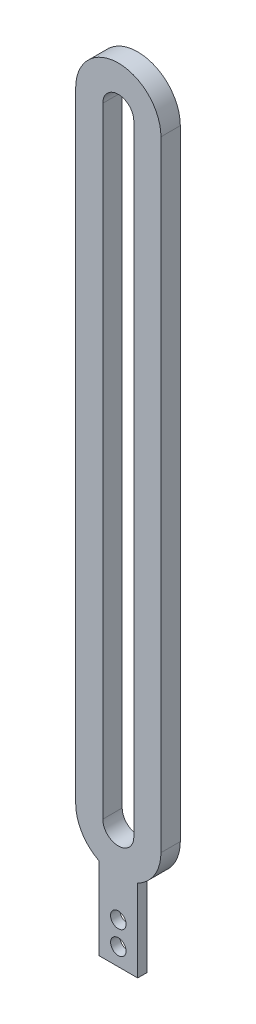
from build123d import *

# Parameters (mm, degrees)
BOSS_EXTRUDE1_DEPTH = 5
BOSS_EXTRUDE2_START = -2.4
BOSS_EXTRUDE2_DEPTH = 2.4
SKETCH3_R           = 2
CUT_EXTRUDE1_DEPTH  = 2.4


with BuildPart() as part:
    # Sketch1 → Boss-Extrude1 (new body)
    with BuildSketch(Plane.XY):
        with BuildLine():
            Line((11, 0), (11, -160))
            ThreePointArc((11, -160), (0, -171), (-11, -160))
            Line((-11, -160), (-11, 0))
            ThreePointArc((-11, 0), (0, 11), (11, 0))
        make_face()
        with BuildLine():
            Line((-4, -160), (-4, 0))
            ThreePointArc((-4, 0), (0, 4), (4, 0))
            Line((4, 0), (4, -160))
            ThreePointArc((4, -160), (0, -164), (-4, -160))
        make_face(mode=Mode.SUBTRACT)
    extrude(amount=BOSS_EXTRUDE1_DEPTH)

    # Sketch2 → Boss-Extrude2 (add)
    with BuildSketch(Plane.XY.offset(5).offset(BOSS_EXTRUDE2_START)):
        with BuildLine():
            Line((-5, -171), (-5, -169.797958971))
            ThreePointArc((-5, -169.797958971), (0, -171), (5, -169.797958971))
            Line((5, -169.797958971), (5, -171))
            Line((5, -171), (5, -191))
            Line((5, -191), (-5, -191))
            Line((-5, -191), (-5, -171))
        make_face()
    extrude(amount=BOSS_EXTRUDE2_DEPTH)

    # Sketch3 → Cut-Extrude1 (cut)
    with BuildSketch(Plane(origin=(0, 0, 2.6), x_dir=(-1, 0, 0), z_dir=(0, 0, -1))):
        with Locations((0, -186.5)):
            Circle(SKETCH3_R)
        with Locations((0, -180.5)):
            Circle(SKETCH3_R)
    extrude(amount=-CUT_EXTRUDE1_DEPTH, mode=Mode.SUBTRACT)


solid = part.part
